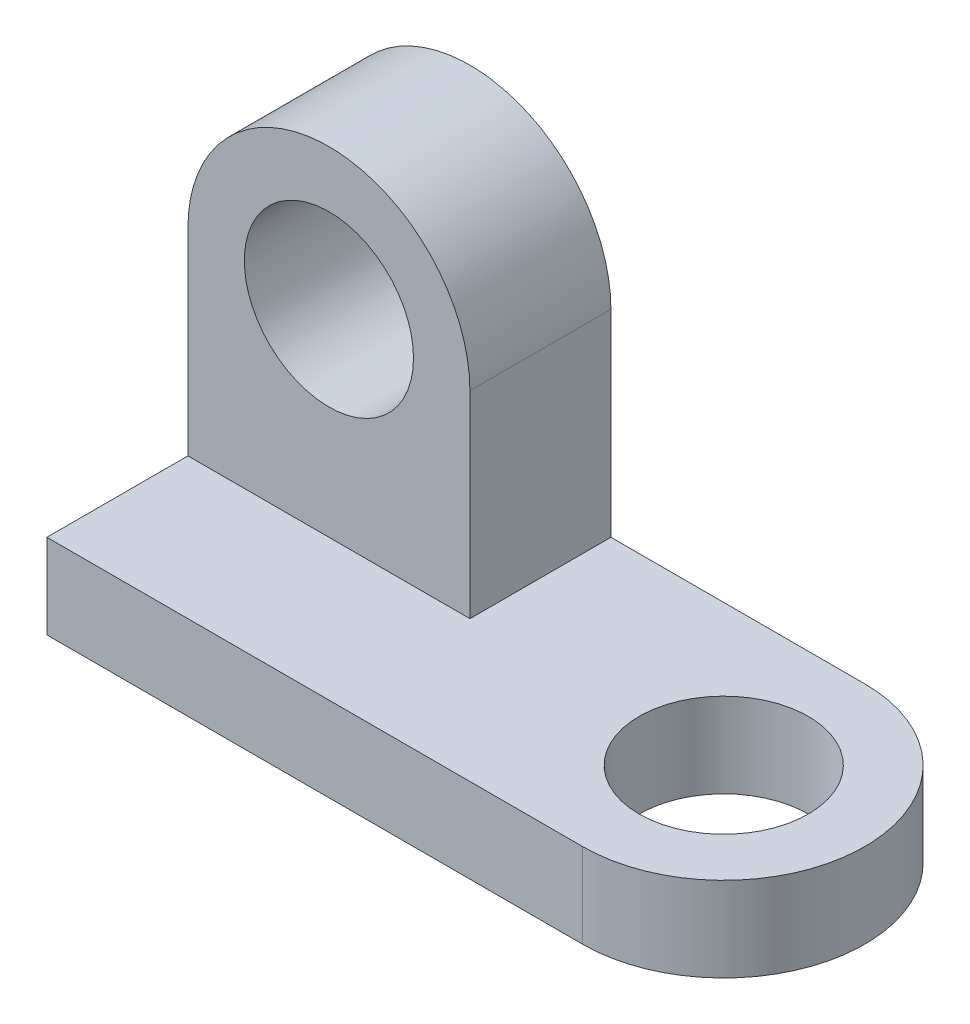
from build123d import *

# Parameters (mm, degrees)
CROQUIS1_W              = 120
CROQUIS1_H              = 50
SALIENTE_EXTRUIR1_DEPTH = 15
CROQUIS2_W              = 50
CROQUIS2_H              = 25
SALIENTE_EXTRUIR2_DEPTH = 60
REDONDEO5_RADIUS        = 25
REDONDEO5_LENGTH        = 25
REDONDEO6_RADIUS        = 25
REDONDEO6_LENGTH        = 15
CROQUIS3_R              = 15
CORTAR_EXTRUIR1_DEPTH   = 89.459030065
CROQUIS4_R              = 15
CORTAR_EXTRUIR2_DEPTH   = 100.247166206


with BuildPart() as part:
    # Croquis1 → Saliente-Extruir1 (new body)
    with BuildSketch(Plane(origin=(0, 0, 0), x_dir=(1, 0, 0), z_dir=(0, 1, 0))):
        Rectangle(CROQUIS1_W, CROQUIS1_H)
    extrude(amount=SALIENTE_EXTRUIR1_DEPTH)

    # Croquis2 → Saliente-Extruir2 (add)
    with BuildSketch(Plane(origin=(0, 15, 0), x_dir=(1, 0, 0), z_dir=(0, 1, 0))):
        with Locations((-35, 12.5)):
            Rectangle(CROQUIS2_W, CROQUIS2_H)
    extrude(amount=SALIENTE_EXTRUIR2_DEPTH)

    # Redondeo5: full round fillet: the end face becomes a half cylinder, R = half its width
    redondeo5_face = Plane((-35, 75, -12.5), x_dir=(0, 0, 1), z_dir=(0, 1, 0))  # on the end face: x along it, z out of the body
    redondeo5_slab = redondeo5_face.offset(-REDONDEO5_RADIUS / 2) * Box(REDONDEO5_LENGTH, 2 * REDONDEO5_RADIUS, REDONDEO5_RADIUS, mode=Mode.PRIVATE)  # the body's end, R deep
    redondeo5_round = Plane((-35, 50, -12.5), x_dir=(0, 1, 0), z_dir=(0, 0, 1)) * Cylinder(REDONDEO5_RADIUS, REDONDEO5_LENGTH, mode=Mode.PRIVATE)  # its axis R under the face
    add(redondeo5_slab - redondeo5_round, mode=Mode.SUBTRACT)

    # Redondeo6: full round fillet: the end face becomes a half cylinder, R = half its width
    redondeo6_face = Plane((60, 7.5, 0), x_dir=(0, -1, 0), z_dir=(1, 0, 0))  # on the end face: x along it, z out of the body
    redondeo6_slab = redondeo6_face.offset(-REDONDEO6_RADIUS / 2) * Box(REDONDEO6_LENGTH, 2 * REDONDEO6_RADIUS, REDONDEO6_RADIUS, mode=Mode.PRIVATE)  # the body's end, R deep
    redondeo6_round = Plane((35, 7.5, 0), x_dir=(1, 0, 0), z_dir=(0, -1, 0)) * Cylinder(REDONDEO6_RADIUS, REDONDEO6_LENGTH, mode=Mode.PRIVATE)  # its axis R under the face
    add(redondeo6_slab - redondeo6_round, mode=Mode.SUBTRACT)

    # Croquis3 → Cortar-Extruir1 (cut, through all)
    with BuildSketch(Plane(origin=(0, 15, 0), x_dir=(1, 0, 0), z_dir=(0, 1, 0))):
        with Locations(Location((35, 0, 0), (0, 0, 270))):
            Circle(CROQUIS3_R)
    extrude(amount=-CORTAR_EXTRUIR1_DEPTH, mode=Mode.SUBTRACT)

    # Croquis4 → Cortar-Extruir2 (cut, through all)
    with BuildSketch(Plane.XY):
        with Locations((-35, 50)):
            Circle(CROQUIS4_R)
    extrude(amount=-CORTAR_EXTRUIR2_DEPTH, mode=Mode.SUBTRACT)


solid = part.part
